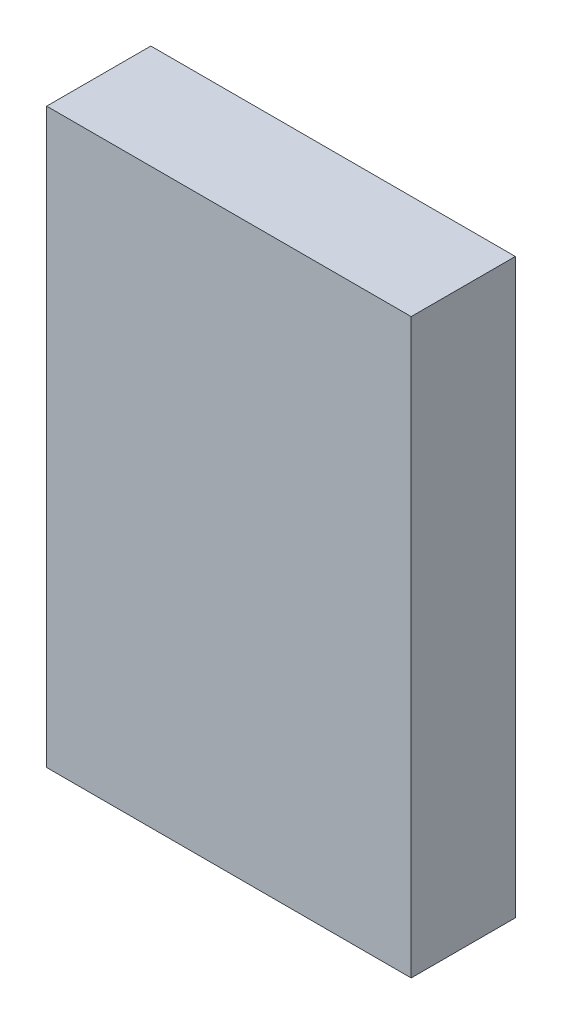
from build123d import *

# Parameters (mm, degrees)
SKETCH1_W           = 14
SKETCH1_H           = 22
BOSS_EXTRUDE1_DEPTH = 2


with BuildPart() as part:
    # Sketch1 → Boss-Extrude1 (new, symmetric)
    with BuildSketch(Plane.XY):
        Rectangle(SKETCH1_W, SKETCH1_H)
    extrude(amount=BOSS_EXTRUDE1_DEPTH, both=True)


solid = part.part
